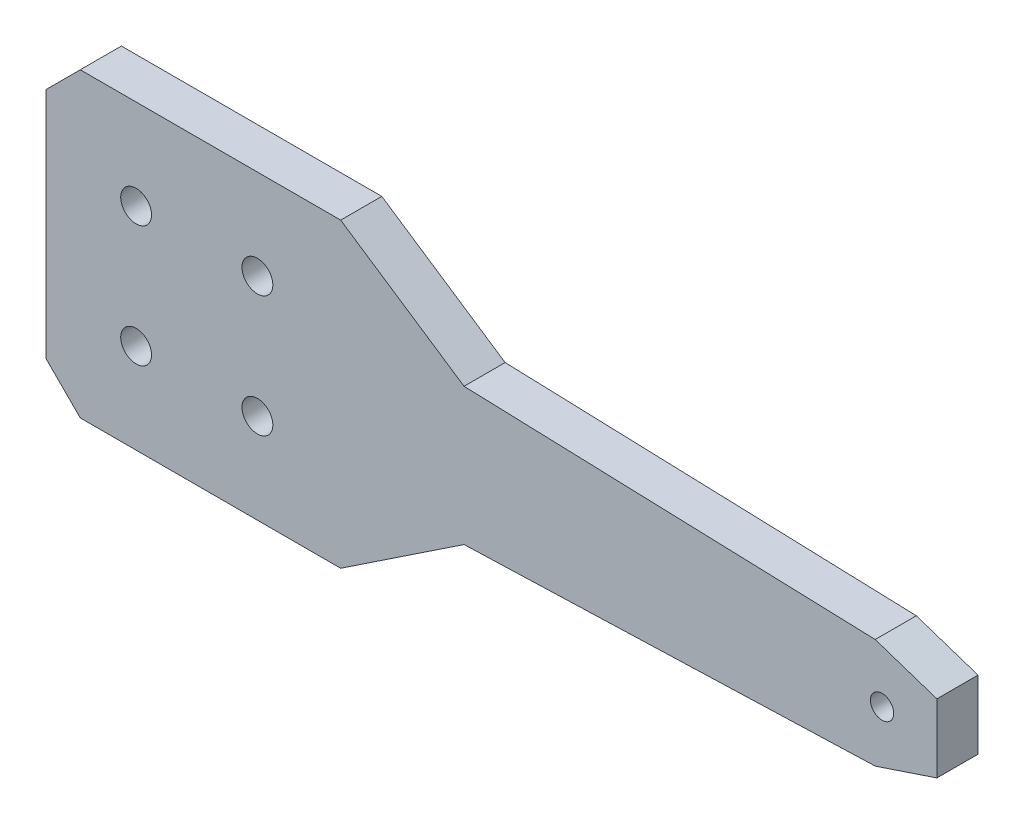
from build123d import *

# Parameters (mm, degrees)
SKETCH_1_R        = 2.25
SKETCH_1_R_2      = 1.7
EXTRUDE_237_DEPTH = 6


with BuildPart() as part:
    # 草图1 → Extrude 237 (new body)
    with BuildSketch(Plane.XY):
        Polygon((-22, -17), (-17, -22), (21, -22), (39, -10), (99, -8), (108, -5), (108, 5), (99, 8), (39, 10), (21, 22), (-17, 22), (-22, 17), align=None)
        with Locations((-8.85, -8.85)):
            Circle(SKETCH_1_R, mode=Mode.SUBTRACT)
        with Locations((-8.85, 8.85)):
            Circle(SKETCH_1_R, mode=Mode.SUBTRACT)
        with Locations((8.85, -8.85)):
            Circle(SKETCH_1_R, mode=Mode.SUBTRACT)
        with Locations((8.85, 8.85)):
            Circle(SKETCH_1_R, mode=Mode.SUBTRACT)
        with Locations((100, 0)):
            Circle(SKETCH_1_R_2, mode=Mode.SUBTRACT)
    extrude(amount=EXTRUDE_237_DEPTH)


solid = part.part
